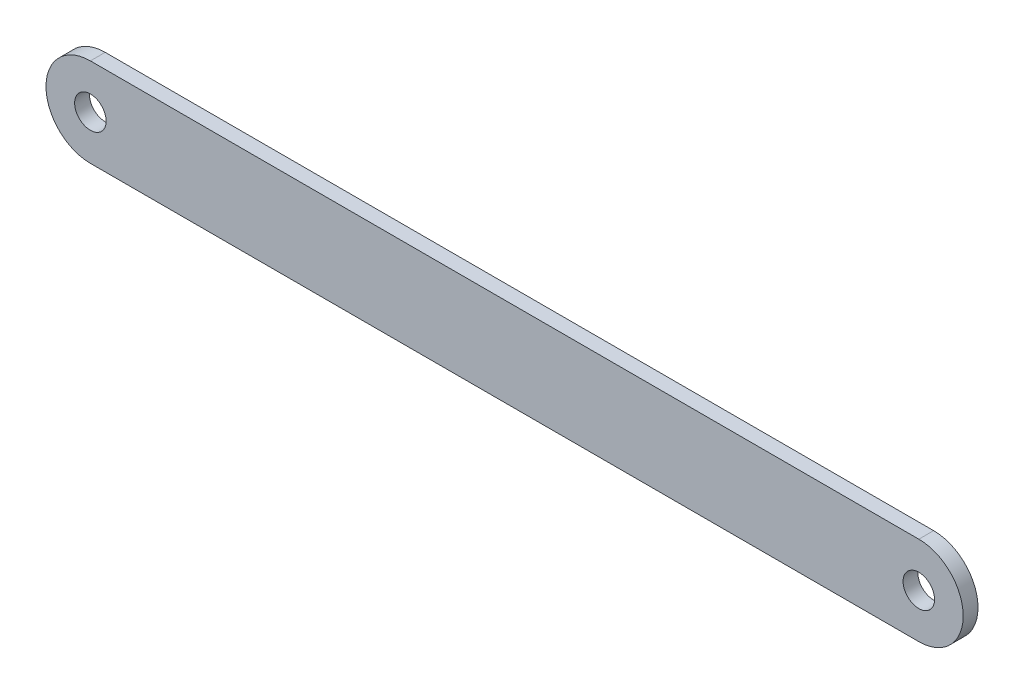
from build123d import *

# Parameters (mm, degrees)
BOSS_EXTRUDE1_DEPTH     = 1.5875
F_1_4_CLEARANCE_HOLE1_D = 6.7564


with BuildPart() as part:
    # Sketch2 → Boss-Extrude1 (new, symmetric)
    with BuildSketch(Plane.XY):
        with BuildLine():
            Line((88.9, -9.525), (-88.9, -9.525))
            ThreePointArc((-88.9, -9.525), (-98.425, 0), (-88.9, 9.525))
            Line((-88.9, 9.525), (88.9, 9.525))
            ThreePointArc((88.9, 9.525), (98.425, 0), (88.9, -9.525))
        make_face()
    extrude(amount=BOSS_EXTRUDE1_DEPTH, both=True)

    # 1/4 Clearance Hole1 (through all)
    with Locations(Plane.XY.offset(1.5875)):
        with Locations((-88.9, 0), (88.9, 0)):
            Hole(F_1_4_CLEARANCE_HOLE1_D / 2)


solid = part.part
